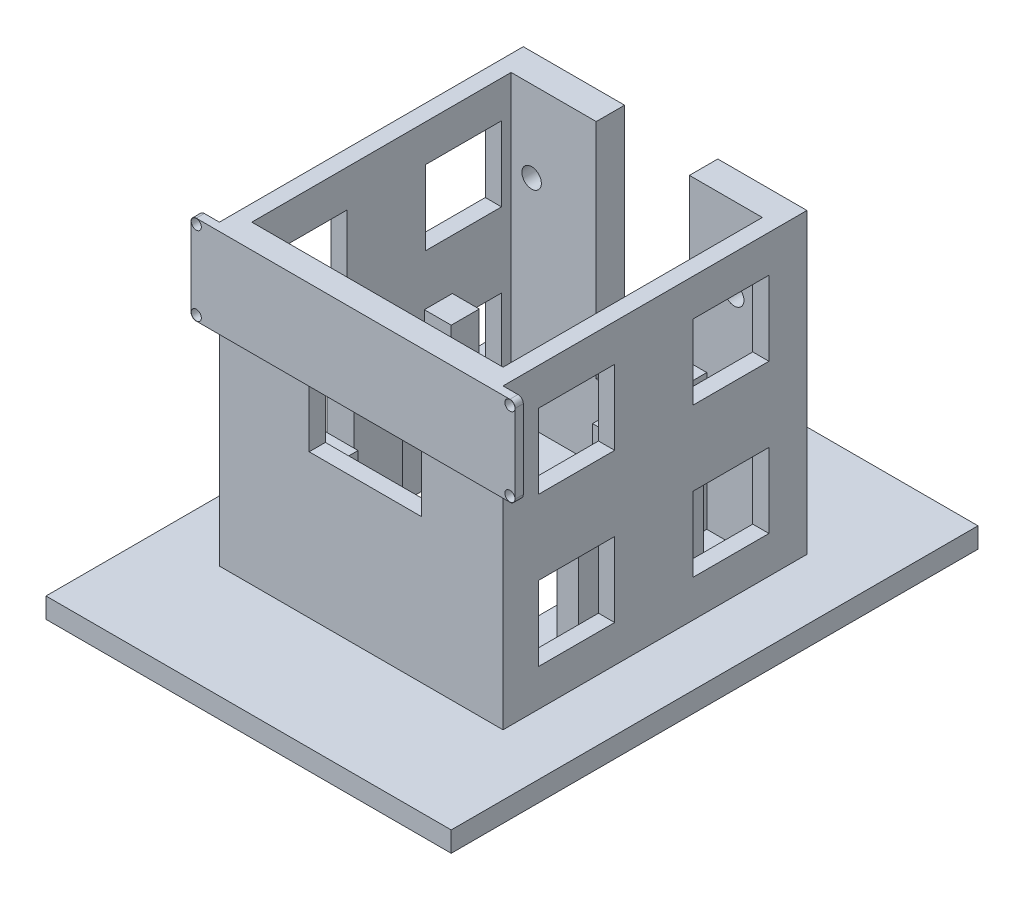
from build123d import *

# Parameters (mm, degrees)
SKETCH_1_W           = 100
SKETCH_1_H           = 130
EXTRUDE_1_DEPTH      = 5
SKETCH_2_W           = 70
SKETCH_2_H           = 75
SKETCH_2_W_2         = 62
SKETCH_2_H_2         = 64
EXTRUDE_2_DEPTH      = 73.5
SKETCH_3_W           = 18.75
SKETCH_3_H           = 18.4
CUT_EXTRUDE_1_DEPTH  = 133.711152508
CUT_EXTRUDE_2_DEPTH  = 10
SKETCH_7_W           = 62
SKETCH_7_H           = 64
CUT_EXTRUDE_3_DEPTH  = 3
SKETCH_8_W           = 30
SKETCH_8_H           = 30
CUT_EXTRUDE_4_DEPTH  = 3
SKETCH_9_R           = 2.4
CUT_EXTRUDE_5_DEPTH  = 112.468605446
SKETCH_11_W          = 14.189150171
SKETCH_11_H          = 10
EXTRUDE_3_DEPTH      = 18.5
SKETCH_12_W          = 4.351362518
SKETCH_12_H          = 10
EXTRUDE_4_DEPTH      = 33.5
SKETCH_13_W          = 6.623564314
SKETCH_13_H          = 6.911719061
SKETCH_13_H_2        = 12.024680345
SKETCH_13_W_2        = 5.320058298
SKETCH_13_W_3        = 8.691671684
SKETCH_13_H_3        = 4.310174588
SKETCH_13_W_4        = 9.602895329
EXTRUDE_5_DEPTH      = 33.5
SKETCH_14_R          = 2.4
CUT_EXTRUDE_6_DEPTH  = 40
EXTRUDE_8_DEPTH      = 2
SKETCH_21_R          = 1.25
CUT_EXTRUDE_9_DEPTH  = 2
SKETCH_22_W          = 27.664468573
SKETCH_22_H          = 16
CUT_EXTRUDE_10_DEPTH = 5
SKETCH_23_W          = 6.623564314
SKETCH_23_H          = 11.962590683
SKETCH_23_W_2        = 19.34597891
SKETCH_23_H_2        = 4.310174588
SKETCH_23_W_3        = 5.320058298
CUT_EXTRUDE_11_DEPTH = 111.123793978


with BuildPart() as part:
    # 草图1 → 凸台-拉伸1 (new body)
    with BuildSketch(Plane(origin=(0, 0, 0), x_dir=(1, 0, 0), z_dir=(0, 1, 0))):
        Rectangle(SKETCH_1_W, SKETCH_1_H)
    extrude(amount=EXTRUDE_1_DEPTH)

    # 草图2 → 凸台-拉伸2 (add)
    with BuildSketch(Plane(origin=(0, 5, 0), x_dir=(1, 0, 0), z_dir=(0, 1, 0))):
        with Locations((0, 0.285714286)):
            Rectangle(SKETCH_2_W, SKETCH_2_H)
        with Locations((0, -1.214285714)):
            Rectangle(SKETCH_2_W_2, SKETCH_2_H_2, mode=Mode.SUBTRACT)
    extrude(amount=EXTRUDE_2_DEPTH)

    # 草图3 → 切除-拉伸1 (cut, through all)
    with BuildSketch(Plane.ZY.offset(35)):
        with Locations((-19.035714286, 60.15)):
            Rectangle(SKETCH_3_W, SKETCH_3_H)
        with Locations((19.035714286, 60.15)):
            Rectangle(SKETCH_3_W, SKETCH_3_H)
        with Locations((19.035714286, 23.35)):
            Rectangle(SKETCH_3_W, SKETCH_3_H)
        with Locations((-19.035714286, 23.35)):
            Rectangle(SKETCH_3_W, SKETCH_3_H)
    extrude(amount=-CUT_EXTRUDE_1_DEPTH, mode=Mode.SUBTRACT)

    # 草图4 → 切除-拉伸2 (cut)
    with BuildSketch(Plane(origin=(0, 0, -37.785714286), x_dir=(-1, 0, 0), z_dir=(0, 0, -1))):
        with BuildLine():
            Line((-13, 78.5), (-13, 35.5))
            Line((-13, 35.5), (-13, 29.5))
            ThreePointArc((-13, 29.5), (-11.242640687, 25.257359313), (-7, 23.5))
            Line((-7, 23.5), (10, 23.5))
            Line((10, 23.5), (10, 78.5))
            Line((10, 78.5), (-13, 78.5))
        make_face()
    extrude(amount=-CUT_EXTRUDE_2_DEPTH, mode=Mode.SUBTRACT)

    # 草图7 → 切除-拉伸3 (cut)
    with BuildSketch(Plane(origin=(0, 0, 0), x_dir=(1, 0, 0), z_dir=(0, 1, 0))):
        with Locations((0, -1.214285714)):
            Rectangle(SKETCH_7_W, SKETCH_7_H)
    extrude(amount=CUT_EXTRUDE_3_DEPTH, mode=Mode.SUBTRACT)

    # 草图8 → 切除-拉伸4 (cut)
    with BuildSketch(Plane.XZ.offset(-3)):
        Rectangle(SKETCH_8_W, SKETCH_8_H)
    extrude(amount=-CUT_EXTRUDE_4_DEPTH, mode=Mode.SUBTRACT)

    # 草图9 → 切除-拉伸5 (cut, through all)
    with BuildSketch(Plane.XZ.offset(-3)):
        with Locations(Location((-23, -23, 0), (0, 0, 270))):
            Circle(SKETCH_9_R)
        with Locations(Location((23, -23, 0), (0, 0, 270))):
            Circle(SKETCH_9_R)
        with Locations(Location((23, 23, 0), (0, 0, 270))):
            Circle(SKETCH_9_R)
        with Locations(Location((-23, 23, 0), (0, 0, 270))):
            Circle(SKETCH_9_R)
    extrude(amount=-CUT_EXTRUDE_5_DEPTH, mode=Mode.SUBTRACT)

    # 草图11 → 凸台-拉伸3 (add)
    with BuildSketch(Plane(origin=(0, 5, 0), x_dir=(1, 0, 0), z_dir=(0, 1, 0))):
        with Locations((6.182659264, 25.785714286)):
            Rectangle(SKETCH_11_W, SKETCH_11_H)
    extrude(amount=EXTRUDE_3_DEPTH)

    # 草图12 → 凸台-拉伸4 (add)
    with BuildSketch(Plane(origin=(0, 5, 0), x_dir=(1, 0, 0), z_dir=(0, 1, 0))):
        with Locations((15.110555439, 25.785714286)):
            Rectangle(SKETCH_12_W, SKETCH_12_H)
    extrude(amount=EXTRUDE_4_DEPTH)

    # 草图13 → 凸台-拉伸5 (add)
    with BuildSketch(Plane(origin=(0, 5, 0), x_dir=(1, 0, 0), z_dir=(0, 1, 0))):
        with Locations((-27.688217843, 12.831804422)):
            Rectangle(SKETCH_13_W, SKETCH_13_H)
        with Locations((-27.688217843, -8.598985965)):
            Rectangle(SKETCH_13_W, SKETCH_13_H_2)
        with Locations((28.339970851, 12.831804422)):
            Rectangle(SKETCH_13_W_2, SKETCH_13_H)
        with Locations((28.339970851, -8.598985965)):
            Rectangle(SKETCH_13_W_2, SKETCH_13_H_2)
        with Locations((-13.432580878, -31.05919842)):
            Rectangle(SKETCH_13_W_3, SKETCH_13_H_3)
        with Locations((15.060681539, -31.05919842)):
            Rectangle(SKETCH_13_W_4, SKETCH_13_H_3)
    extrude(amount=EXTRUDE_5_DEPTH)

    # 草图14 → 切除-拉伸6 (cut)
    with BuildSketch(Plane(origin=(0, 0, -37.785714286), x_dir=(-1, 0, 0), z_dir=(0, 0, -1))):
        with Locations((-24.05892938, 58.5)):
            Circle(SKETCH_14_R)
        with Locations((25.94107062, 58.5)):
            Circle(SKETCH_14_R)
    extrude(amount=-CUT_EXTRUDE_6_DEPTH, mode=Mode.SUBTRACT)

    # 草图20 → 凸台-拉伸8 (add)
    with BuildSketch(Plane.XY.offset(37.214285714)):
        with BuildLine():
            Line((-38.7, 56.5), (38.7, 56.5))
            ThreePointArc((38.7, 56.5), (39.619238816, 56.880761184), (40, 57.8))
            Line((40, 57.8), (40, 77.2))
            ThreePointArc((40, 77.2), (39.619238816, 78.119238816), (38.7, 78.5))
            Line((38.7, 78.5), (-38.7, 78.5))
            ThreePointArc((-38.7, 78.5), (-39.619238816, 78.119238816), (-40, 77.2))
            Line((-40, 77.2), (-40, 57.8))
            ThreePointArc((-40, 57.8), (-39.619238816, 56.880761184), (-38.7, 56.5))
        make_face()
    extrude(amount=EXTRUDE_8_DEPTH)

    # 草图21 → 切除-拉伸9 (cut)
    with BuildSketch(Plane.XY.offset(39.214285714)):
        with Locations((-38.7, 77.2)):
            Circle(SKETCH_21_R)
        with Locations((-38.7, 57.8)):
            Circle(SKETCH_21_R)
        with Locations((38.7, 77.2)):
            Circle(SKETCH_21_R)
        with Locations((38.7, 57.8)):
            Circle(SKETCH_21_R)
    extrude(amount=-CUT_EXTRUDE_9_DEPTH, mode=Mode.SUBTRACT)

    # 草图22 → 切除-拉伸10 (cut)
    with BuildSketch(Plane.XY.offset(37.214285714)):
        with Locations((0.99347539, 48.5)):
            Rectangle(SKETCH_22_W, SKETCH_22_H)
    extrude(amount=-CUT_EXTRUDE_10_DEPTH, mode=Mode.SUBTRACT)

    # 草图23 → 切除-拉伸11 (cut, through all)
    with BuildSketch(Plane(origin=(0, 5, 0), x_dir=(1, 0, 0), z_dir=(0, 1, 0))):
        with Locations((-27.688217843, 3.39464955)):
            Rectangle(SKETCH_23_W, SKETCH_23_H)
        with Locations((0.586244419, -31.05919842)):
            Rectangle(SKETCH_23_W_2, SKETCH_23_H_2)
        with Locations((28.339970851, 3.39464955)):
            Rectangle(SKETCH_23_W_3, SKETCH_23_H)
    extrude(amount=-CUT_EXTRUDE_11_DEPTH, mode=Mode.SUBTRACT)


solid = part.part
